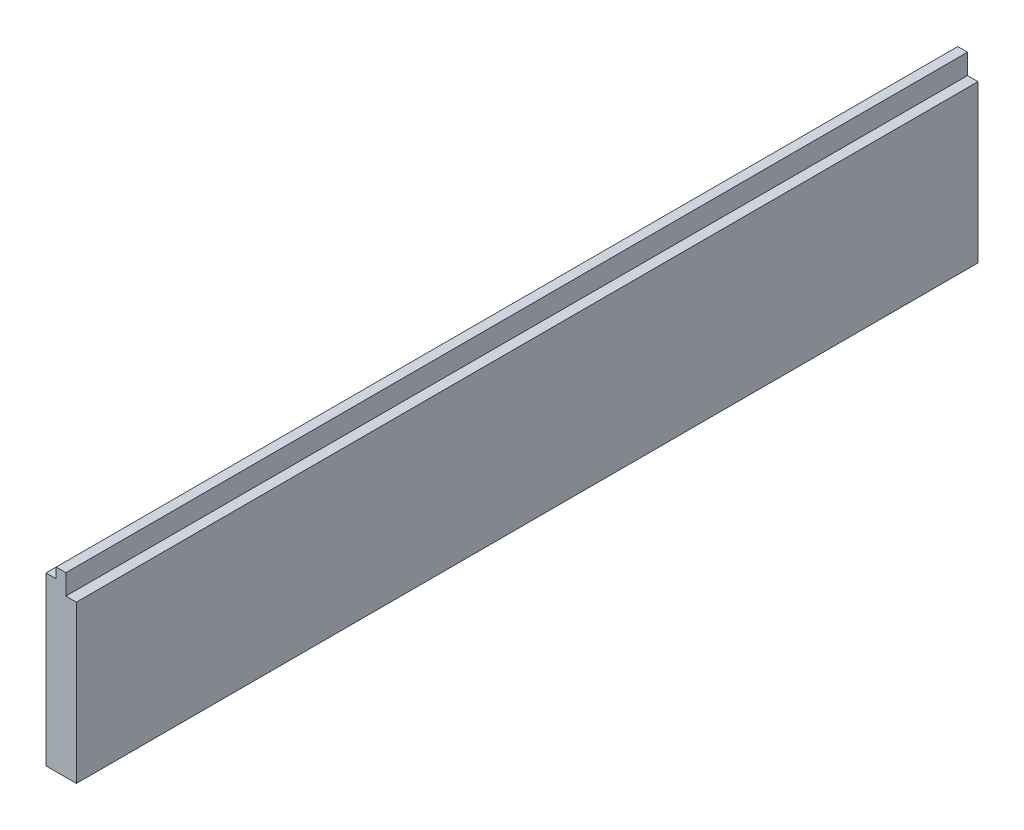
from build123d import *

# Parameters (mm, degrees)
EXTRUDE_1_DEPTH = 890


with BuildPart() as part:
    # Эскиз1 → Бобышка-Вытянуть1 (new body)
    with BuildSketch(Plane.XY):
        Polygon((0, 0), (30, 0), (30, 155), (19.661947875, 155), (19.661947875, 175), (10, 175), (10, 165), (0, 165), align=None)
    extrude(amount=EXTRUDE_1_DEPTH)


solid = part.part
